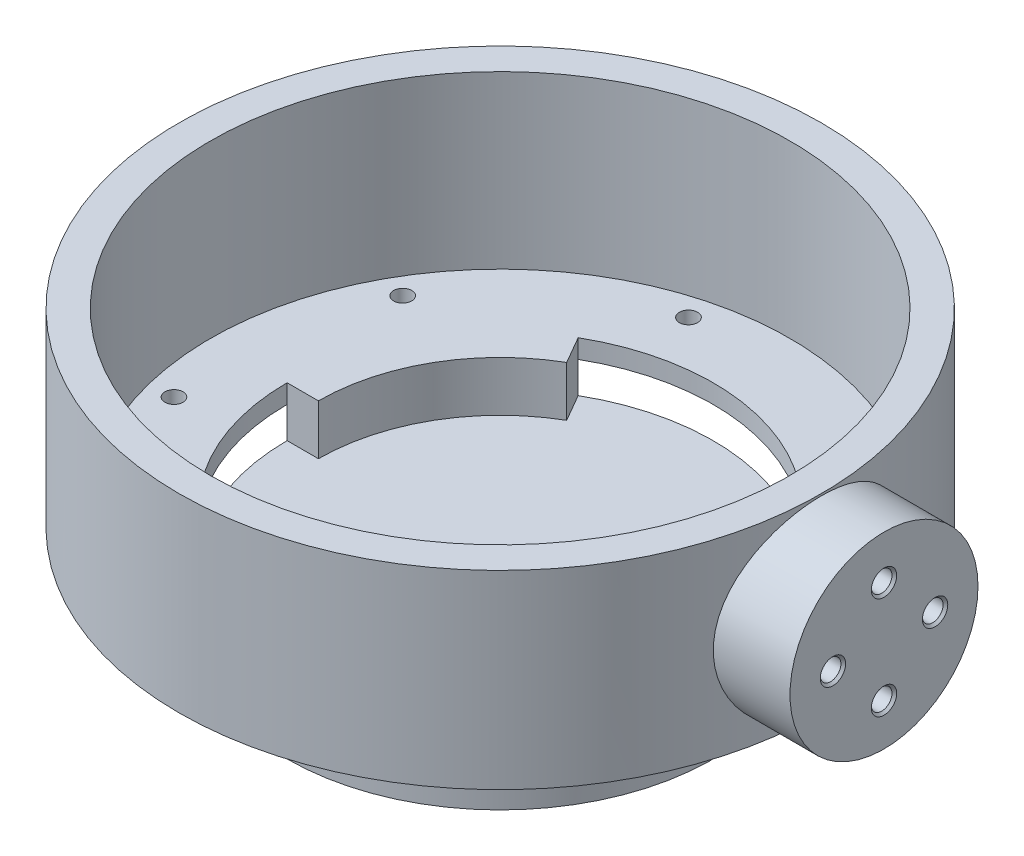
from build123d import *
from build123d.topology import SkipClean

# Parameters (mm, degrees)
EXTRUDE_2_DEPTH                = 5
EXTRUDE_2_DEPTH_BACK           = 5
SKETCH_1_R                     = 34
EXTRUDE_3_DEPTH                = 8
EXTRUDE_START                  = -3
SKETCH_3_R                     = 46.25
SKETCH_3_R_2                   = 34
EXTRUDE_4_DEPTH                = 3
EXTRUDE_5_DEPTH                = 27.3
EXTRUDE_5_DEPTH_BACK           = 3
SKETCH_4_R                     = 51.25
SKETCH_4_R_2                   = 46.25
HOLE_WIZARD_M3_5_1_D           = 2.9
HOLE_WIZARD_M3_5_1_CSINK_D     = 3.55
HOLE_WIZARD_M3_5_1_CSINK_ANGLE = 90
PATTERN_CIRCULAR_2_COUNT       = 8
EXTRUDE_6_DEPTH                = 10
EXTRUDE_6_DEPTH_BACK           = 4
SKETCH_11_R                    = 15
PATTERN_CIRCULAR_3_COUNT       = 4


with BuildPart() as part:
    # 草图1 → 凸台-拉伸2 (new, two sides: drawn at the far end of the back side and taken through both)
    with BuildSketch(Plane(origin=(0, 0, 0), x_dir=(1, 0, 0), z_dir=(0, 1, 0)).offset(-EXTRUDE_2_DEPTH_BACK)):
        with Locations(Location((0, 0, 0), (0, 0, 270))):
            Circle(SKETCH_1_R)
    extrude(amount=EXTRUDE_2_DEPTH + EXTRUDE_2_DEPTH_BACK)

    # 草图2 → 凸台-拉伸3 (add)
    with SkipClean():  # the faces are left unmerged after this step: merging them gives an invalid solid
        with BuildSketch(Plane(origin=(0, 5, 0), x_dir=(1, 0, 0), z_dir=(0, 1, 0))):
            with BuildLine():
                Line((-34, 0), (-29, 0))
                ThreePointArc((-29, 0), (-25.11473671, 14.5), (-14.5, 25.11473671))
                Line((-14.5, 25.11473671), (-17, 29.444863729))
                ThreePointArc((-17, 29.444863729), (-29.444863729, 17), (-34, 0))
            make_face()
            with BuildLine():
                Line((29, 0), (34, 0))
                ThreePointArc((34, 0), (29.444863729, -17), (17, -29.444863729))
                Line((17, -29.444863729), (14.5, -25.11473671))
                ThreePointArc((14.5, -25.11473671), (25.11473671, -14.5), (29, 0))
            make_face()
        extrude(amount=EXTRUDE_3_DEPTH)

    # 草图3 → 凸台-拉伸4 (add)
    with SkipClean():  # the faces are left unmerged after this step: merging them gives an invalid solid
        with BuildSketch(Plane(origin=(0, 13, 0), x_dir=(1, 0, 0), z_dir=(0, 1, 0)).offset(EXTRUDE_START)):
            with Locations(Location((0, 0, 0), (0, 0, 270))):
                Circle(SKETCH_3_R)
            with Locations(Location((0, 0, 0), (0, 0, 270))):
                Circle(SKETCH_3_R_2, mode=Mode.SUBTRACT)
        extrude(amount=EXTRUDE_4_DEPTH)

    # 草图4 → 凸台-拉伸5 (add, two sides: drawn at the far end of the back side and taken through both)
    with SkipClean():  # the faces are left unmerged after this step: merging them gives an invalid solid
        with BuildSketch(Plane(origin=(0, 13, 0), x_dir=(1, 0, 0), z_dir=(0, 1, 0)).offset(-EXTRUDE_5_DEPTH_BACK)):
            with Locations(Location((0, 0, 0), (0, 0, 270))):
                Circle(SKETCH_4_R)
            with Locations(Location((0, 0, 0), (0, 0, 270))):
                Circle(SKETCH_4_R_2, mode=Mode.SUBTRACT)
        extrude(amount=EXTRUDE_5_DEPTH + EXTRUDE_5_DEPTH_BACK)

    # M3.5 螺纹孔1 (through all)
    with Locations(Plane.XZ.offset(-10)):
        with Locations((36.806079661, 21.25)):
            hole_wizard_m3_5_1 = CounterSinkHole(HOLE_WIZARD_M3_5_1_D / 2, HOLE_WIZARD_M3_5_1_CSINK_D / 2, counter_sink_angle=HOLE_WIZARD_M3_5_1_CSINK_ANGLE)

    # 阵列(圆周)2: M3.5 螺纹孔1 ×8 about axis
    with SkipClean():  # the faces are left unmerged after this step: merging them gives an invalid solid
        pattern_circular_2_axis = Axis((0, 0, 0), (0, 1, 0))
        for i in range(1, PATTERN_CIRCULAR_2_COUNT):
            add(hole_wizard_m3_5_1.rotate(pattern_circular_2_axis, i * 360 / PATTERN_CIRCULAR_2_COUNT), mode=Mode.SUBTRACT)

    # 草图11 → 凸台-拉伸6 (add, two sides: drawn at the far end of the back side and taken through both)
    with SkipClean():  # the faces are left unmerged after this step: merging them gives an invalid solid
        with BuildSketch(Plane(origin=(51.25, 0, 0), x_dir=(0, 0, -1), z_dir=(1, 0, 0)).offset(-EXTRUDE_6_DEPTH_BACK)):
            with Locations((0, 25)):
                Circle(SKETCH_11_R)
        extrude(amount=EXTRUDE_6_DEPTH + EXTRUDE_6_DEPTH_BACK)

    # 草图14 → M4 螺纹孔1 (revolve, cut)
    with SkipClean():  # the faces are left unmerged after this step: merging them gives an invalid solid
        with BuildSketch(Plane(origin=(61.25, 33, 0), x_dir=(0, 0, -1), z_dir=(0, 1, 0))):
            Polygon((0, 0), (0, 11.091420021), (1.65, 10.1), (1.65, 0.375), (2.025, 0), align=None)
        hole_wizard_m4_1 = revolve(axis=Axis((67.6, 33, 0), (-1, 0, 0)), mode=Mode.SUBTRACT)

    # 阵列(圆周)3: M4 螺纹孔1 ×4 about axis
    with SkipClean():  # the faces are left unmerged after this step: merging them gives an invalid solid
        pattern_circular_3_axis = Axis((0, 24.851493468, 0), (1, 0, 0))
        for i in range(1, PATTERN_CIRCULAR_3_COUNT):
            add(hole_wizard_m4_1.rotate(pattern_circular_3_axis, i * 360 / PATTERN_CIRCULAR_3_COUNT), mode=Mode.SUBTRACT)


solid = part.part
